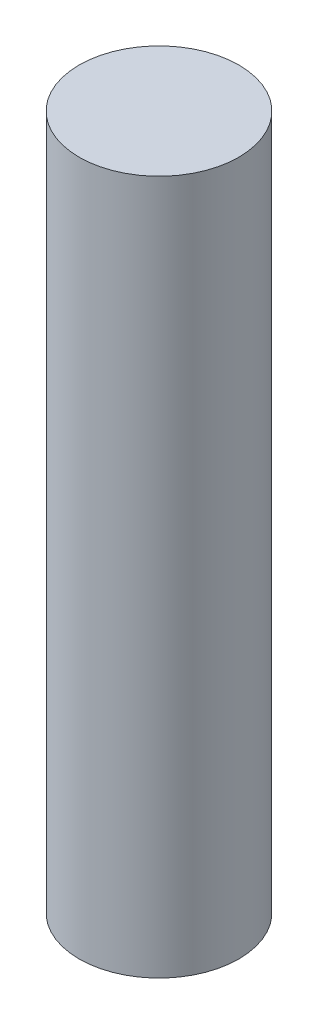
from build123d import *

# Parameters (mm, degrees)
SKETCH1_R           = 3.45
BOSS_EXTRUDE1_DEPTH = 30


with BuildPart() as part:
    # Sketch1 → Boss-Extrude1 (new body)
    with BuildSketch(Plane(origin=(0, 0, 0), x_dir=(1, 0, 0), z_dir=(0, 1, 0))):
        with Locations(Location((0, 0, 0), (0, 0, 270))):
            Circle(SKETCH1_R)
    extrude(amount=BOSS_EXTRUDE1_DEPTH)


solid = part.part
